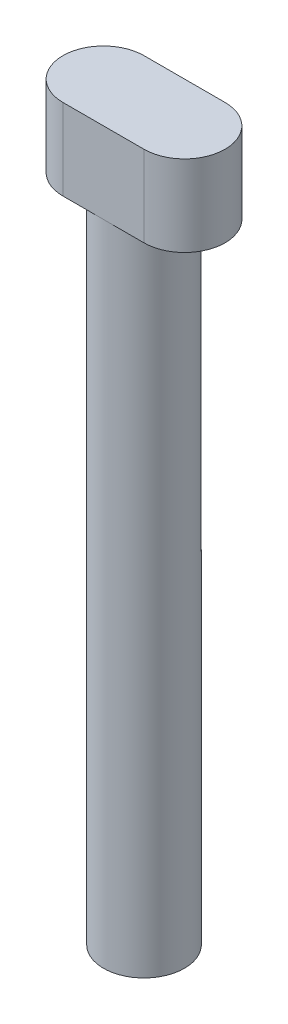
from build123d import *

# Parameters (mm, degrees)
BOSS_EXTRUDE1_DEPTH = 101.6
BOSS_EXTRUDE3_DEPTH = 12.7


with BuildPart() as part:
    # Sketch1 → Boss-Extrude1 (new body)
    with BuildSketch(Plane(origin=(0, 0, 0), x_dir=(1, 0, 0), z_dir=(0, 1, 0))):
        with BuildLine():
            Line((-5.499261314, 3.175), (-5.499261314, -3.175))
            ThreePointArc((-5.499261314, -3.175), (1.643500936, -6.133628997), (6.35, 0))
            ThreePointArc((6.35, 0), (1.643500936, 6.133628997), (-5.499261314, 3.175))
        make_face()
    extrude(amount=-BOSS_EXTRUDE1_DEPTH)

    # Sketch4 → Boss-Extrude3 (add)
    with BuildSketch(Plane(origin=(0, 0, 0), x_dir=(1, 0, 0), z_dir=(0, 1, 0))):
        with BuildLine():
            Line((-6.35, 6.35), (6.35, 6.35))
            ThreePointArc((6.35, 6.35), (12.7, 0), (6.35, -6.35))
            Line((6.35, -6.35), (-6.35, -6.35))
            ThreePointArc((-6.35, -6.35), (-12.7, 0), (-6.35, 6.35))
        make_face()
    extrude(amount=BOSS_EXTRUDE3_DEPTH)


solid = part.part
